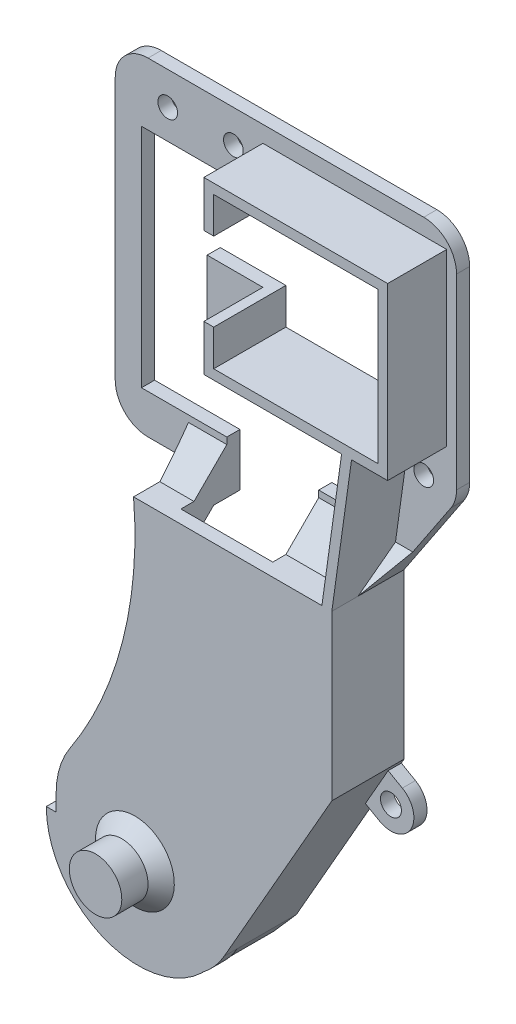
from build123d import *

# Parameters (mm, degrees)
EXTRUDE_1_DEPTH                 = 52
CUT_EXTRUDE_1_REACH             = 124.004
CUT_EXTRUDE_1_DIRECTION_2_DEPTH = 7
SKETCH_3_R                      = 1.5
CUT_EXTRUDE_2_DEPTH             = 123.167917229
SKETCH_5_R                      = 4
EXTRUDE_3_DEPTH                 = 8
FILLET_1_R                      = 5
CHAMFER_1_SIZE                  = 5
FILLET_2_R                      = 12.5
EXTRUDE_2_DEPTH                 = 9
CHAMFER_2_SIZE                  = 5
EXTRUDE_4_DEPTH                 = 9
EXTRUDE_4_DEPTH_BACK            = 2
CHAMFER_3_SIZE                  = 2
SKETCH_7_R                      = 1.6
EXTRUDE_5_DEPTH                 = 2


with BuildPart() as part:
    # 草图1 → 凸台-拉伸1 (new body)
    with BuildSketch(Plane(origin=(0, 0, 0), x_dir=(0, 0, -1), z_dir=(1, 0, 0))):
        Polygon((0, 0), (0, 58), (9, 58), (9, 110), (7, 110), (7, 60), (-2, 60), (-2, 0), align=None)
    extrude(amount=EXTRUDE_1_DEPTH)

    # 草图2 → 切除-拉伸1 (cut, up to next)
    with BuildSketch(Plane.XY.offset(-7), mode=Mode.PRIVATE) as cut_extrude_1_sk1:
        Polygon((24, 106), (49, 106), (49, 83), (24, 83), (24, 88.5), (14, 88.5), (14, 77), (41, 77), (41, 66), (31, 66), (31, 58), (17, 58), (17, 66), (4, 66), (4, 100.5), (24, 100.5), align=None)
    cut_extrude_1_tool1 = extrude(cut_extrude_1_sk1.sketch, amount=-CUT_EXTRUDE_1_REACH, mode=Mode.PRIVATE) & part.part
    add(cut_extrude_1_tool1.solids().sort_by_distance((25.692202, 84.595066, -7))[0], mode=Mode.SUBTRACT)

    # 草图2 → 切除-拉伸1 direction 2 (cut)
    with BuildSketch(Plane.XY.offset(-7)):
        Polygon((24, 106), (49, 106), (49, 83), (24, 83), (24, 88.5), (14, 88.5), (14, 77), (41, 77), (41, 66), (31, 66), (31, 58), (17, 58), (17, 66), (4, 66), (4, 100.5), (24, 100.5), align=None)
    extrude(amount=CUT_EXTRUDE_1_DIRECTION_2_DEPTH, mode=Mode.SUBTRACT)

    # 草图3 → 切除-拉伸2 (cut, through all)
    with BuildSketch(Plane.XY.offset(2)):
        with Locations((8, 105)):
            Circle(SKETCH_3_R)
        with Locations((18, 105)):
            Circle(SKETCH_3_R)
        with Locations((47, 76)):
            Circle(SKETCH_3_R)
        with BuildLine():
            Line((0, 60), (11.791303716, 60))
            ThreePointArc((11.791303716, 60), (9.662737441, 38.416613409), (0, 19))
            Line((0, 19), (0, 60))
        make_face()
        Polygon((42, 35), (42, 60), (52, 75), (52, 0), (22, 0), align=None)
    extrude(amount=-CUT_EXTRUDE_2_DEPTH, mode=Mode.SUBTRACT)

    # 草图5 → 凸台-拉伸3 (add)
    with BuildSketch(Plane(origin=(0, 0, 0), x_dir=(-1, 0, 0), z_dir=(0, 0, -1))):
        with Locations(Location((-12, 12, 0), (0, 0, 90))):
            Circle(SKETCH_5_R)
    extrude(amount=-EXTRUDE_3_DEPTH)

    # 圆角1
    fillet_1_edges = [part.edges().sort_by_distance(p)[0] for p in [
        (52, 75, -8),
        (0, 60, -8),
        (52, 110, -8),
        (0, 110, -8),
    ]]
    fillet(fillet_1_edges, radius=FILLET_1_R)

    # 倒角1
    chamfer_1_edges = [part.edges().sort_by_distance(p)[0] for p in [
        (14.395651858, 60, -7),
        (36.5, 60, -7),
    ]]
    chamfer(chamfer_1_edges, length=CHAMFER_1_SIZE)

    # 圆角2
    fillet_2_edges = [part.edges().sort_by_distance(p)[0] for p in [
        (22, 0, 1),
        (0, 0, 1),
        (0, 19, 1),
    ]]
    fillet(fillet_2_edges, radius=FILLET_2_R)

    # 草图4 → 凸台-拉伸2 (add)
    with BuildSketch(Plane.XY.offset(-7)):
        Polygon((24, 88.5), (24, 83), (49, 83), (49, 106), (24, 106), (24, 100.5), (22.5, 100.5), (22.5, 107.5), (50.5, 107.5), (50.5, 81.5), (45, 81.5), (42, 60), (40.485467906, 60), (43.485467906, 81.5), (22.5, 81.5), (22.5, 88.5), align=None)
    extrude(amount=EXTRUDE_2_DEPTH)

    # 倒角2
    chamfer_2_edges = [part.edges().sort_by_distance(p)[0] for p in [
        (14.462476533, 58, 0),
        (36.5, 58, 0),
    ]]
    chamfer(chamfer_2_edges, length=CHAMFER_2_SIZE)

    # 草图6 → 凸台-拉伸4 (add, two sides: drawn at the far end of the back side and taken through both)
    with BuildSketch(Plane(origin=(0, 0, 0), x_dir=(-1, 0, 0), z_dir=(0, 0, -1)).offset(-EXTRUDE_4_DEPTH_BACK)):
        with BuildLine():
            Line((-40.5, 60), (-42, 60))
            Line((-42, 60), (-42, 35))
            Line((-42, 35), (-25.599007583, 6.298263271))
            Line((-25.599007583, 6.298263271), (-22.133485774, 2.341459168))
            ThreePointArc((-22.133485774, 2.341459168), (-6.971383575, -0.362130478), (1.5, 12.5))
            Line((1.5, 12.5), (0, 12.5))
            ThreePointArc((0, 12.5), (-7.235227504, 1.162797057), (-20.565147291, 2.949952923))
            Line((-20.565147291, 2.949952923), (-24.572792271, 7.525733129))
            Line((-24.572792271, 7.525733129), (-40.5, 35.398346656))
            Line((-40.5, 35.398346656), (-40.5, 60))
        make_face()
    extrude(amount=EXTRUDE_4_DEPTH + EXTRUDE_4_DEPTH_BACK)

    # 倒角3
    chamfer_3_edges = [part.edges().sort_by_distance(p)[0] for p in [
        (12, 8, 2),
    ]]
    chamfer(chamfer_3_edges, length=CHAMFER_3_SIZE)

    # 草图7 → 凸台-拉伸5 (add)
    with BuildSketch(Plane(origin=(0, 0, -9), x_dir=(-1, 0, 0), z_dir=(0, 0, -1))):
        with BuildLine():
            Line((-41.58264013, 34.269620228), (-43.736486284, 33.038850997))
            ThreePointArc((-43.736486284, 33.038850997), (-45.038850997, 28.263513716), (-40.263513716, 26.961149003))
            Line((-40.263513716, 26.961149003), (-38.109667562, 28.191918233))
            Line((-38.109667562, 28.191918233), (-41.58264013, 34.269620228))
        make_face()
        with Locations(Location((-42, 30, 0), (0, 0, 90))):
            Circle(SKETCH_7_R, mode=Mode.SUBTRACT)
    extrude(amount=-EXTRUDE_5_DEPTH)


solid = part.part
